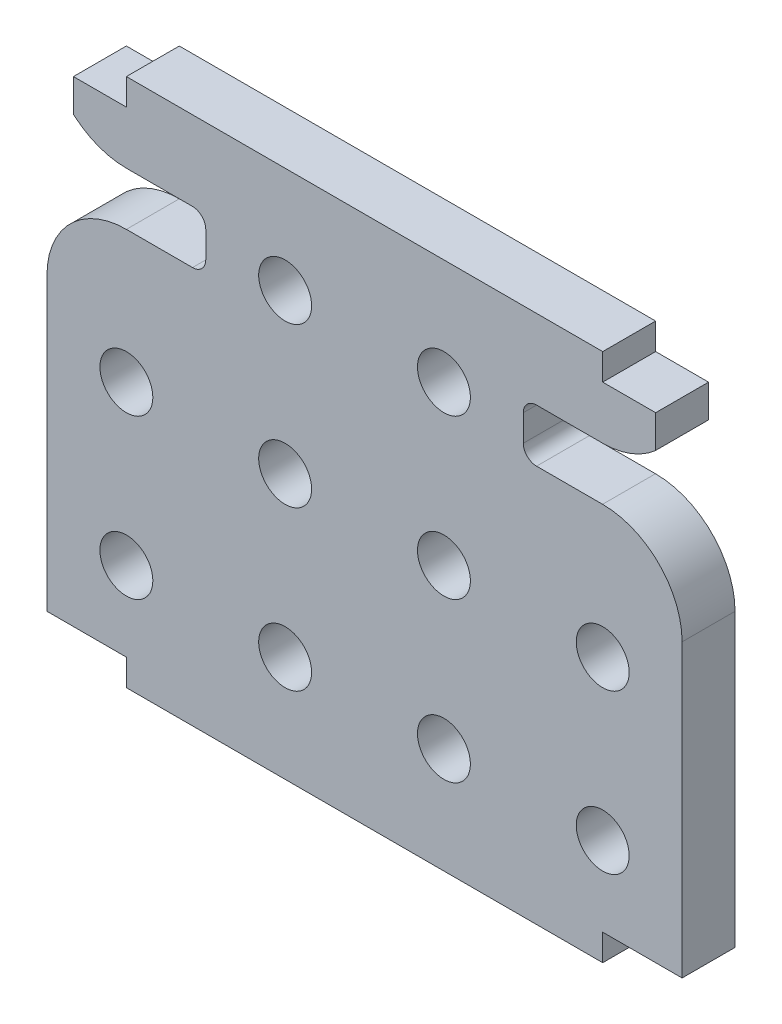
from build123d import *

# Parameters (mm, degrees)
MODEL_R                 = 1.5
SALIENTE_EXTRUIR1_DEPTH = 3


with BuildPart() as part:
    # Model → Saliente-Extruir1 (new body)
    with BuildSketch(Plane.XY):
        with BuildLine():
            Line((110.375172306, 209.589330986), (110.375172306, 208.089330986))
            Line((110.375172306, 208.089330986), (107.375172306, 208.089330986))
            Line((107.375172306, 208.089330986), (107.375172306, 206.23522902))
            ThreePointArc((107.375172306, 206.23522902), (108.769472902, 205.385555371), (110.375172306, 205.089330986))
            Line((110.375172306, 205.089330986), (114.125172656, 205.089330986))
            ThreePointArc((114.125172656, 205.089330986), (114.655502742, 204.869661072), (114.875172656, 204.339330986))
            Line((114.875172656, 204.339330986), (114.875172656, 202.839330986))
            ThreePointArc((114.875172656, 202.839330986), (114.655502742, 202.3090009), (114.125172656, 202.089330986))
            Line((114.125172656, 202.089330986), (110.375172306, 202.089330986))
            ThreePointArc((110.375172306, 202.089330986), (107.192564198, 200.770683786), (105.875172656, 197.587555713))
            Line((105.875172656, 197.587555713), (105.875172656, 181.089330986))
            Line((105.875172656, 181.089330986), (110.375172306, 181.089330986))
            Line((110.375172306, 181.089330986), (110.375172306, 179.589330986))
            Line((110.375172306, 179.589330986), (137.375172656, 179.589330986))
            Line((137.375172656, 179.589330986), (137.375172656, 181.089330986))
            Line((137.375172656, 181.089330986), (141.875172656, 181.089330986))
            Line((141.875172656, 181.089330986), (141.875172306, 197.589330986))
            ThreePointArc((141.875172306, 197.589330986), (140.554536331, 200.773925842), (137.367774797, 202.089324906))
            Line((137.367774797, 202.089324906), (133.625176703, 202.089319857))
            ThreePointArc((133.625176703, 202.089319857), (133.09484632, 202.308989056), (132.875175691, 202.839318846))
            Line((132.875175691, 202.839318846), (132.875173667, 204.339318846))
            ThreePointArc((132.875173667, 204.339318846), (133.094842866, 204.869649228), (133.625172656, 205.089319857))
            Line((133.625172656, 205.089319857), (137.375178726, 205.089324916))
            ThreePointArc((137.375178726, 205.089324916), (138.980875531, 205.385553219), (140.375172656, 206.23522902))
            Line((140.375172656, 206.23522902), (140.375172656, 208.089330986))
            Line((140.375172656, 208.089330986), (137.375172656, 208.089330986))
            Line((137.375172656, 208.089330986), (137.375165869, 209.589324916))
            Line((137.375165869, 209.589324916), (110.375172306, 209.589330986))
        make_face()
        with Locations((110.375172306, 185.589330986)):
            Circle(MODEL_R, mode=Mode.SUBTRACT)
        with Locations((119.375172306, 185.589330986)):
            Circle(MODEL_R, mode=Mode.SUBTRACT)
        with Locations((128.375172306, 185.589330986)):
            Circle(MODEL_R, mode=Mode.SUBTRACT)
        with Locations((137.375172306, 185.589330986)):
            Circle(MODEL_R, mode=Mode.SUBTRACT)
        with Locations((110.375172306, 194.589330986)):
            Circle(MODEL_R, mode=Mode.SUBTRACT)
        with Locations((119.375172306, 194.589330986)):
            Circle(MODEL_R, mode=Mode.SUBTRACT)
        with Locations((119.375172656, 203.589330986)):
            Circle(MODEL_R, mode=Mode.SUBTRACT)
        with Locations((128.375172306, 194.589330986)):
            Circle(MODEL_R, mode=Mode.SUBTRACT)
        with Locations((137.375172306, 194.589330986)):
            Circle(MODEL_R, mode=Mode.SUBTRACT)
        with Locations((128.375172656, 203.589330986)):
            Circle(MODEL_R, mode=Mode.SUBTRACT)
    extrude(amount=SALIENTE_EXTRUIR1_DEPTH)


solid = part.part
